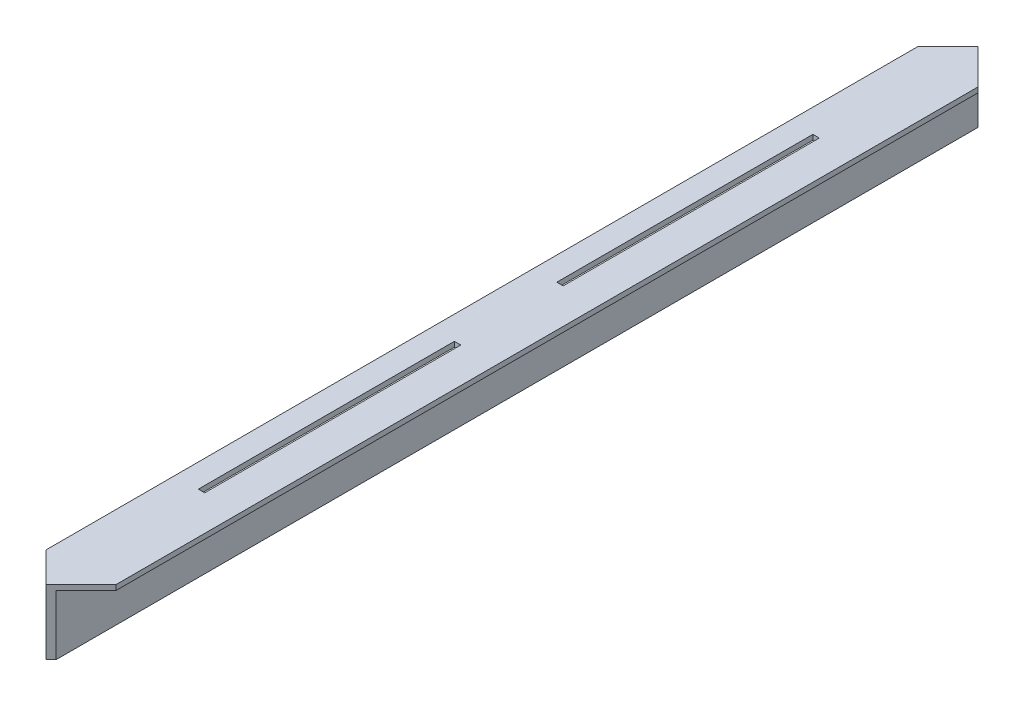
from build123d import *

# Parameters (mm, degrees)
RESSALTO_EXTRUS_O1_DEPTH = 182
CORTE_EXTRUS_O1_DEPTH    = 50
ESBO_O3_W                = 2.5
ESBO_O3_H                = 100
CORTE_EXTRUS_O2_DEPTH    = 185.202198684
CORTE_EXTRUS_O3_DEPTH    = 50


with BuildPart() as part:
    # Esboço1 → Ressalto-extrusão1 (new, symmetric)
    with BuildSketch(Plane.XY):
        Polygon((-12.7, 0), (12.7, 0), (12.7, -2), (1, -2), (1, -25.4), (-1, -25.4), (-1, -2), (-12.7, -2), align=None)
    extrude(amount=RESSALTO_EXTRUS_O1_DEPTH, both=True)

    # Esboço2 → Corte-extrusão1 (cut, symmetric)
    with BuildSketch(Plane(origin=(0, 0, 0), x_dir=(1, 0, 0), z_dir=(0, 1, 0))):
        Polygon((-1, 182), (12.7, 168.3), (12.7, 182), align=None)
        Polygon((-1, -182), (12.7, -168.3), (12.7, -182), align=None)
    extrude(amount=CORTE_EXTRUS_O1_DEPTH, both=True, mode=Mode.SUBTRACT)

    # Esboço3 → Corte-extrusão2 (cut, through all)
    with BuildSketch(Plane(origin=(0, 0, 0), x_dir=(1, 0, 0), z_dir=(0, 1, 0))):
        with Locations((-2.25, 70)):
            Rectangle(ESBO_O3_W, ESBO_O3_H)
        with Locations((-2.25, -70)):
            Rectangle(ESBO_O3_W, ESBO_O3_H)
    extrude(amount=-CORTE_EXTRUS_O2_DEPTH, mode=Mode.SUBTRACT)

    # Esboço4 → Corte-extrusão3 (cut, symmetric)
    with BuildSketch(Plane(origin=(0, 0, 0), x_dir=(1, 0, 0), z_dir=(0, 1, 0))):
        Polygon((-1, 182), (-12.7, 170.3), (-12.7, 182), align=None)
        Polygon((-1, -182), (-12.7, -170.3), (-12.7, -182), align=None)
    extrude(amount=CORTE_EXTRUS_O3_DEPTH, both=True, mode=Mode.SUBTRACT)


solid = part.part
